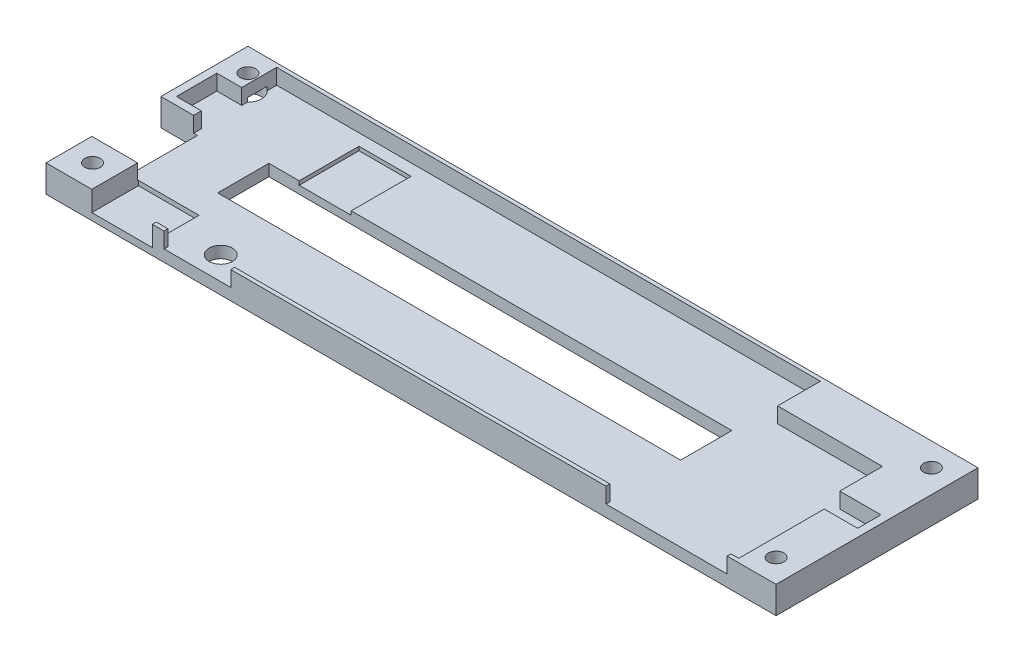
from build123d import *

# Parameters (mm, degrees)
SKETCH_1_W           = 94
SKETCH_1_H           = 26
SKETCH_1_R           = 1
EXTRUDE_1_DEPTH      = 3.5
SKETCH_2_W           = 4.7
SKETCH_2_H           = 8.9
SKETCH_2_W_2         = 59.6
SKETCH_2_H_2         = 6.6
CUT_EXTRUDE_1_DEPTH  = 49.890183064
SKETCH_3_R           = 1.5
CUT_EXTRUDE_2_DEPTH  = 49.890183064
SKETCH_4_R           = 1.75
CUT_EXTRUDE_3_DEPTH  = 2
SKETCH_5_W           = 7.8
SKETCH_5_H           = 2.6
SKETCH_5_W_2         = 8.6
SKETCH_5_H_2         = 2
CUT_EXTRUDE_4_DEPTH  = 6
SKETCH_5_3_W         = 15.6
SKETCH_5_3_H         = 2
CUT_EXTRUDE_5_DEPTH  = 20
SKETCH_6_W           = 70
SKETCH_6_H           = 19.6
SKETCH_6_W_2         = 18.8
SKETCH_6_H_2         = 3
SKETCH_6_W_3         = 82.8
SKETCH_6_H_3         = 11
SKETCH_6_W_4         = 3.2
SKETCH_6_H_4         = 5.2
CUT_EXTRUDE_12_DEPTH = 2
SKETCH_7_W           = 6.7
SKETCH_7_H           = 7.7
CUT_EXTRUDE_13_DEPTH = 0.5


with BuildPart() as part:
    # 草图1 → 凸台-拉伸1 (new body)
    with BuildSketch(Plane(origin=(0, 0, 0), x_dir=(1, 0, 0), z_dir=(0, 1, 0))):
        Rectangle(SKETCH_1_W, SKETCH_1_H)
        with Locations(Location((-44, 10, 0), (0, 0, 270))):
            Circle(SKETCH_1_R, mode=Mode.SUBTRACT)
        with Locations(Location((-44, -10, 0), (0, 0, 270))):
            Circle(SKETCH_1_R, mode=Mode.SUBTRACT)
        with Locations(Location((44, 10, 0), (0, 0, 270))):
            Circle(SKETCH_1_R, mode=Mode.SUBTRACT)
        with Locations(Location((44, -10, 0), (0, 0, 270))):
            Circle(SKETCH_1_R, mode=Mode.SUBTRACT)
    extrude(amount=EXTRUDE_1_DEPTH)

    # 草图2 → 切除-拉伸1 (cut, through all)
    with BuildSketch(Plane.XZ):
        with Locations((-44.65, 2.65)):
            Rectangle(SKETCH_2_W, SKETCH_2_H)
        with Locations((-4.8, 0)):
            Rectangle(SKETCH_2_W_2, SKETCH_2_H_2)
    extrude(amount=-CUT_EXTRUDE_1_DEPTH, mode=Mode.SUBTRACT)

    # 草图3 → 切除-拉伸2 (cut, through all)
    with BuildSketch(Plane(origin=(0, 0, 0), x_dir=(-1, 0, 0), z_dir=(0, -1, 0))):
        with Locations(Location((27.5, -10, 0), (0, 0, 90))):
            Circle(SKETCH_3_R)
    extrude(amount=-CUT_EXTRUDE_2_DEPTH, mode=Mode.SUBTRACT)

    # 草图4 → 切除-拉伸3 (cut)
    with BuildSketch(Plane.XZ):
        with Locations(Location((-44, 10, 0), (0, 0, 270))):
            Circle(SKETCH_4_R)
        with Locations(Location((-44, -10, 0), (0, 0, 270))):
            Circle(SKETCH_4_R)
        with Locations(Location((44, 10, 0), (0, 0, 270))):
            Circle(SKETCH_4_R)
        with Locations(Location((44, -10, 0), (0, 0, 270))):
            Circle(SKETCH_4_R)
    extrude(amount=-CUT_EXTRUDE_3_DEPTH, mode=Mode.SUBTRACT)

    # 草图5 → 切除-拉伸4 (cut)
    with BuildSketch(Plane.XY.offset(13)):
        with Locations((-37.2, 2.2)):
            Rectangle(SKETCH_5_W, SKETCH_5_H)
        with Locations((-27.5, 2.5)):
            Rectangle(SKETCH_5_W_2, SKETCH_5_H_2)
    extrude(amount=-CUT_EXTRUDE_4_DEPTH, mode=Mode.SUBTRACT)

    # 草图5<3> → 切除-拉伸5 (cut)
    with BuildSketch(Plane.XY.offset(13)):
        with Locations((32.9, 2.5)):
            Rectangle(SKETCH_5_3_W, SKETCH_5_3_H)
    extrude(amount=-CUT_EXTRUDE_5_DEPTH, mode=Mode.SUBTRACT)

    # 草图6 → 切除-拉伸12 (cut)
    with BuildSketch(Plane(origin=(0, 3.5, 0), x_dir=(1, 0, 0), z_dir=(0, 1, 0))):
        with Locations((-7.8, 2.7)):
            Rectangle(SKETCH_6_W, SKETCH_6_H)
        with Locations((36.6, 0)):
            Rectangle(SKETCH_6_W_2, SKETCH_6_H_2)
        with Locations((0.3, -7)):
            Rectangle(SKETCH_6_W_3, SKETCH_6_H_3)
        with Locations((-44.4, 5.4)):
            Rectangle(SKETCH_6_W_4, SKETCH_6_H_4)
    extrude(amount=-CUT_EXTRUDE_12_DEPTH, mode=Mode.SUBTRACT)

    # 草图7 → 切除-拉伸13 (cut)
    with BuildSketch(Plane(origin=(0, 1.5, 0), x_dir=(1, 0, 0), z_dir=(0, 1, 0))):
        with Locations((-27.35, 7.15)):
            Rectangle(SKETCH_7_W, SKETCH_7_H)
    extrude(amount=-CUT_EXTRUDE_13_DEPTH, mode=Mode.SUBTRACT)


solid = part.part
